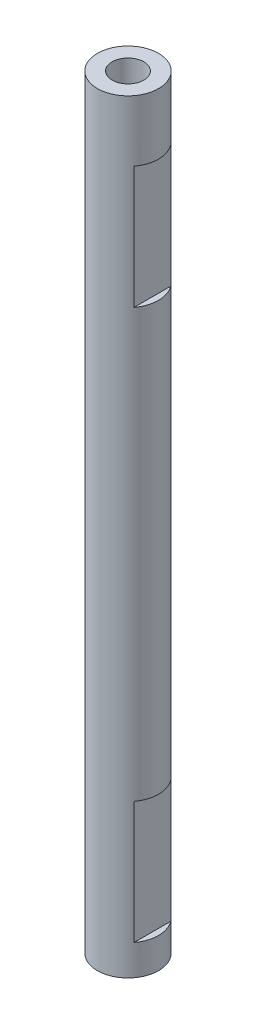
from build123d import *

# Parameters (mm, degrees)
SKETCH_1_R          = 5
EXTRUDE_1_DEPTH     = 125
M5X0_8_D            = 5.2
M5X0_8_DEPTH        = 16
M5X0_8_TIP          = 1.562237609
M5X0_8_2_D          = 5.2
M5X0_8_2_DEPTH      = 16
M5X0_8_2_TIP        = 1.562237609
CUT_EXTRUDE_START   = -20
CUT_EXTRUDE_5_DEPTH = 20
CUT_EXTRUDE_6_DEPTH = 20


with BuildPart() as part:
    # ｽｹｯﾁ1 → ﾎﾞｽ - 押し出し1 (new body)
    with BuildSketch(Plane(origin=(0, 0, 0), x_dir=(1, 0, 0), z_dir=(0, 1, 0))):
        with Locations(Location((0, 0, 0), (0, 0, 270))):
            Circle(SKETCH_1_R)
    extrude(amount=EXTRUDE_1_DEPTH)

    # M5x0.8
    with Locations(Plane.ZX.offset(125)):
        with Locations((0, 0)):
            Hole(M5X0_8_D / 2, depth=M5X0_8_DEPTH)
            with Locations((0, 0, -(M5X0_8_DEPTH + M5X0_8_TIP / 2))):  # 118° drill point
                Cone(0, M5X0_8_D / 2, M5X0_8_TIP, mode=Mode.SUBTRACT)

    # M5x0.8 2
    with Locations(Plane(origin=(0, 0, 0), x_dir=(0, 0, -1), z_dir=(0, -1, 0))):
        with Locations((0, 0)):
            Hole(M5X0_8_2_D / 2, depth=M5X0_8_2_DEPTH)
            with Locations((0, 0, -(M5X0_8_2_DEPTH + M5X0_8_2_TIP / 2))):  # 118° drill point
                Cone(0, M5X0_8_2_D / 2, M5X0_8_2_TIP, mode=Mode.SUBTRACT)

    # ｽｹｯﾁ8 → ｶｯﾄ - 押し出し5 (cut)
    with BuildSketch(Plane(origin=(0, 115, 0), x_dir=(1, 0, 0), z_dir=(0, 1, 0)).offset(CUT_EXTRUDE_START)):
        with BuildLine():
            ThreePointArc((4, 3), (5, 0), (4, -3))
            Line((4, -3), (4, 3))
        make_face()
        with BuildLine():
            Line((-4, -2.309397765), (-4, 0))
            Line((-4, 0), (-5, 0))
            ThreePointArc((-5, 0), (-4.74341649, -1.58113883), (-4, -3))
            Line((-4, -3), (-4, -2.309397765))
        make_face()
        with BuildLine():
            Line((-5, 0), (-4, 0))
            Line((-4, 0), (-4, 3))
            ThreePointArc((-4, 3), (-4.74341649, 1.58113883), (-5, 0))
        make_face()
    extrude(amount=CUT_EXTRUDE_5_DEPTH, mode=Mode.SUBTRACT)

    # ｽｹｯﾁ9 → ｶｯﾄ - 押し出し6 (cut)
    with BuildSketch(Plane(origin=(0, 5, 0), x_dir=(-1, 0, 0), z_dir=(0, -1, 0))):
        with BuildLine():
            Line((-4, 3), (-4, -3))
            ThreePointArc((-4, -3), (-5, 0), (-4, 3))
        make_face()
        with BuildLine():
            Line((4, -3), (4, 3))
            ThreePointArc((4, 3), (5, 0), (4, -3))
        make_face()
    extrude(amount=-CUT_EXTRUDE_6_DEPTH, mode=Mode.SUBTRACT)


solid = part.part
